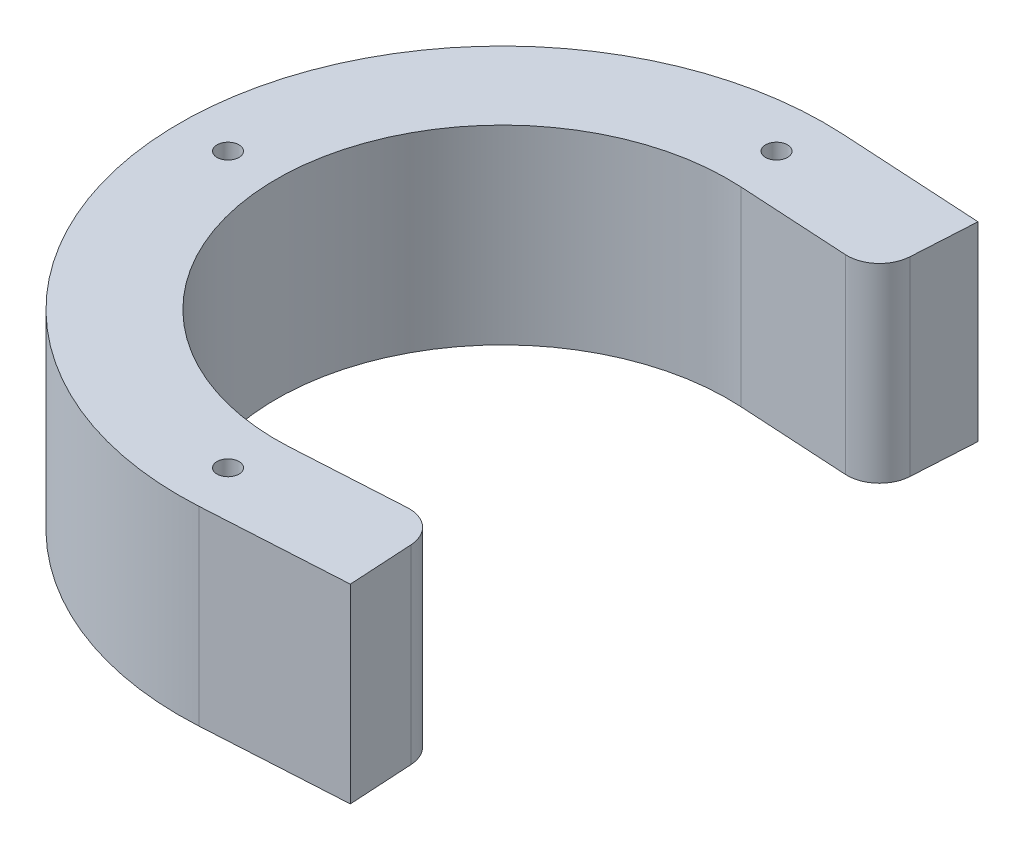
from build123d import *

# Parameters (mm, degrees)
SKETCH2_R           = 1.7
BOSS_EXTRUDE1_DEPTH = 29.5
FILLET2_R           = 5


with BuildPart() as part:
    # Sketch2 → Boss-Extrude1 (new body)
    with BuildSketch(Plane(origin=(0, 0, 0), x_dir=(1, 0, 0), z_dir=(0, 1, 0))):
        with BuildLine():
            Line((2.88691348, 49.91658773), (25.08691348, 48.632656232))
            Line((25.08691348, 48.632656232), (24.220839436, 33.657679913))
            Line((24.220839436, 33.657679913), (2.020839436, 34.941611411))
            ThreePointArc((2.020839436, 34.941611411), (-35, 0), (2.020839436, -34.941611411))
            Line((2.020839436, -34.941611411), (24.220839436, -33.657679913))
            Line((24.220839436, -33.657679913), (25.08691348, -48.632656232))
            Line((25.08691348, -48.632656232), (2.88691348, -49.91658773))
            ThreePointArc((2.88691348, -49.91658773), (-50, 0), (2.88691348, 49.91658773))
        make_face()
        with Locations(Location((-42.5, 0, 0), (0, 0, 270))):
            Circle(SKETCH2_R, mode=Mode.SUBTRACT)
        with Locations(Location((0, 42.5, 0), (0, 0, 270))):
            Circle(SKETCH2_R, mode=Mode.SUBTRACT)
        with Locations(Location((0, -42.5, 0), (0, 0, 90))):
            Circle(SKETCH2_R, mode=Mode.SUBTRACT)
    extrude(amount=BOSS_EXTRUDE1_DEPTH)

    # Fillet2
    fillet2_edges = [part.edges().sort_by_distance(p)[0] for p in [
        (24.220839436, 14.75, -33.657679913),
        (24.220839436, 14.75, 33.657679913),
    ]]
    fillet(fillet2_edges, radius=FILLET2_R)


solid = part.part
